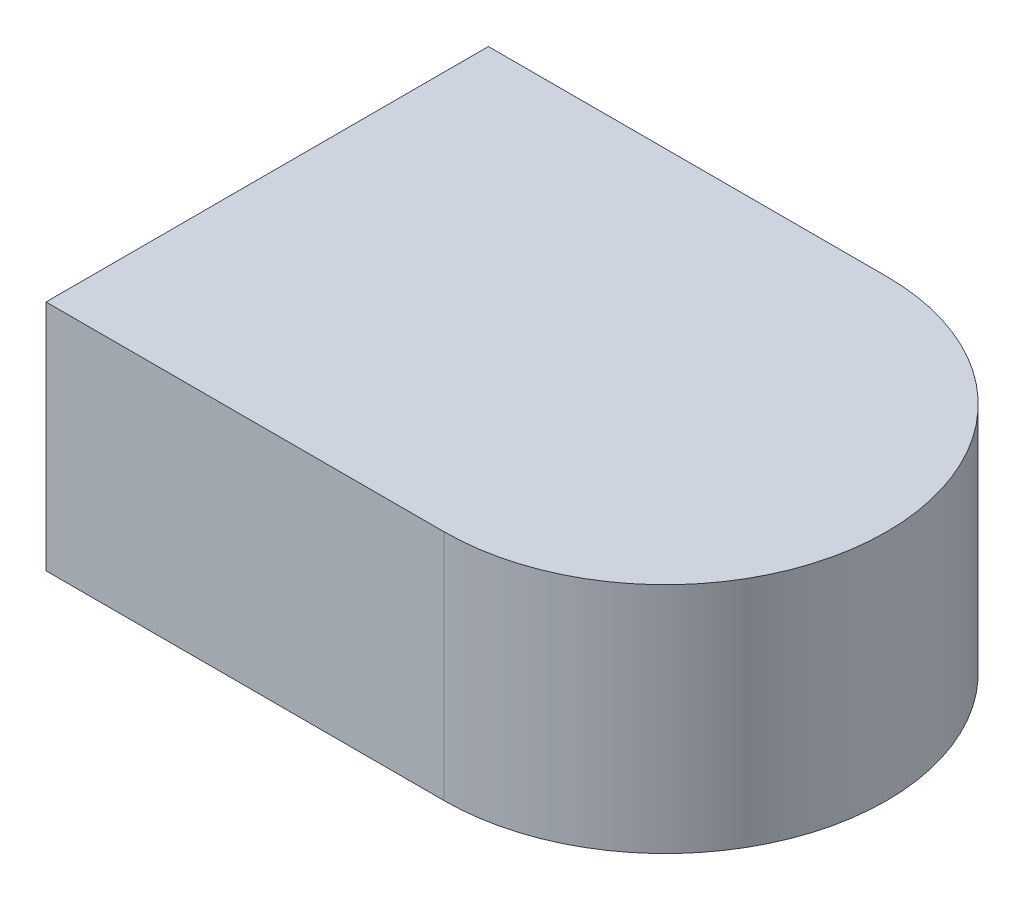
from build123d import *

# Parameters (mm, degrees)
BOSS_EXTRUDE1_DEPTH = 10


with BuildPart() as part:
    # Sketch1 → Boss-Extrude1 (new body)
    with BuildSketch(Plane(origin=(0, 0, 0), x_dir=(1, 0, 0), z_dir=(0, 1, 0))):
        with BuildLine():
            Line((0, 0), (17.1, 0))
            ThreePointArc((17.1, 0), (26.6, 9.5), (17.1, 19))
            Line((17.1, 19), (0, 19))
            Line((0, 19), (0, 0))
        make_face()
    extrude(amount=BOSS_EXTRUDE1_DEPTH)


solid = part.part
